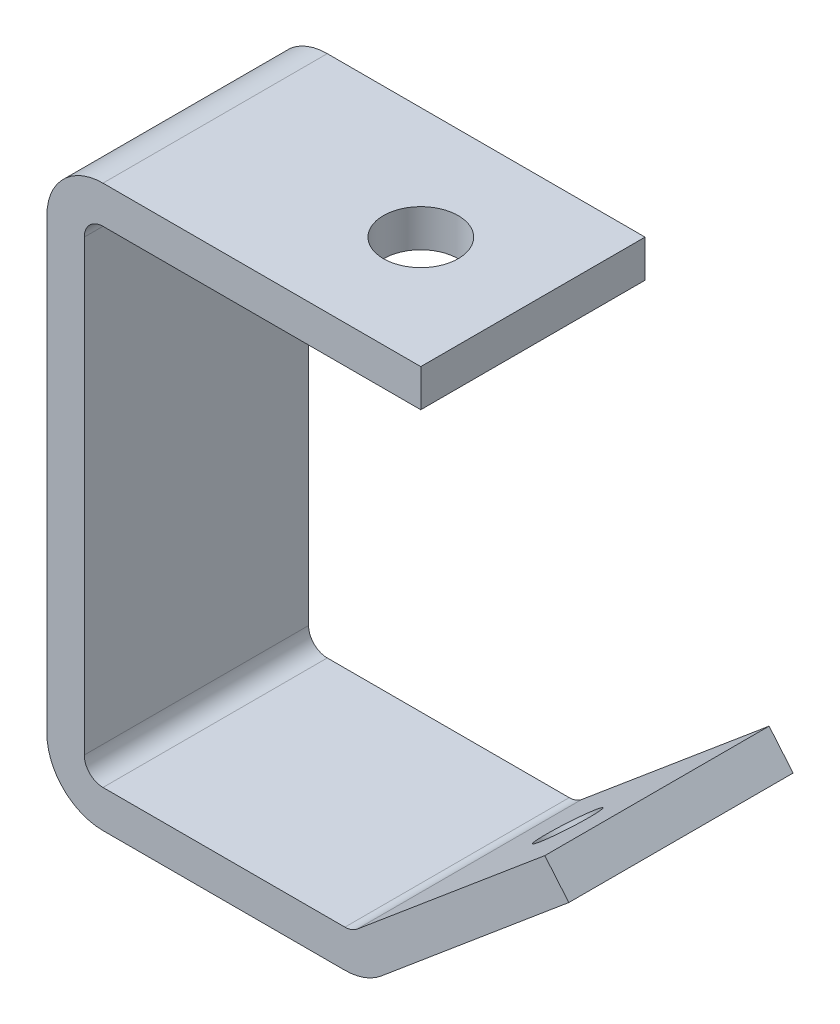
from build123d import *

# Parameters (mm, degrees)
BOSS_EXTRUDE1_DEPTH = 19.05
SKETCH2_R           = 6.35
CUT_EXTRUDE1_DEPTH  = 21.43
SKETCH3_R           = 4.765
CUT_EXTRUDE2_DEPTH  = 46.1


with BuildPart() as part:
    # Sketch1 → Boss-Extrude1 (new, symmetric)
    with BuildSketch(Plane.XY):
        with BuildLine():
            Line((-3.494114249, 0), (-44.59, 0))
            ThreePointArc((-44.59, 0), (-51.328727625, 2.791272375), (-54.12, 9.53))
            Line((-54.12, 9.53), (-54.12, 85.72))
            ThreePointArc((-54.12, 85.72), (-51.328727625, 92.458727625), (-44.59, 95.25))
            Line((-44.59, 95.25), (9.39, 95.25))
            Line((9.39, 95.25), (9.39, 88.9))
            Line((9.39, 88.9), (-44.59, 88.9))
            ThreePointArc((-44.59, 88.9), (-46.838599564, 87.968599564), (-47.77, 85.72))
            Line((-47.77, 85.72), (-47.77, 9.53))
            ThreePointArc((-47.77, 9.53), (-46.838599564, 7.281400436), (-44.59, 6.35))
            Line((-44.59, 6.35), (-3.494114249, 6.35))
            ThreePointArc((-3.494114249, 6.35), (-2.382548783, 6.545998982), (-1.405054517, 7.11035556))
            Line((-1.405054517, 7.11035556), (30.459242619, 33.847675535))
            Line((30.459242619, 33.847675535), (34.54094394, 28.983293321))
            Line((34.54094394, 28.983293321), (2.676646804, 2.245973346))
            ThreePointArc((2.676646804, 2.245973346), (-0.210720873, 0.57895084), (-3.494114249, 0))
        make_face()
    extrude(amount=BOSS_EXTRUDE1_DEPTH, both=True)

    # Sketch2 → Cut-Extrude1 (cut)
    with BuildSketch(Plane(origin=(0, 95.25, 0), x_dir=(1, 0, 0), z_dir=(0, 1, 0))):
        with Locations(Location((-9.65, 0, 0), (0, 0, 270))):
            Circle(SKETCH2_R)
    extrude(amount=-CUT_EXTRUDE1_DEPTH, mode=Mode.SUBTRACT)

    # Sketch3 → Cut-Extrude2 (cut)
    with BuildSketch(Plane(origin=(-4.081701322, 4.864382214, 0), x_dir=(0.7660444431189815, 0.6427876096865353, 0), z_dir=(-0.6427876096865353, 0.7660444431189815, 0))):
        with Locations(Location((25.29, 0, 0), (0, 0, 180))):
            Circle(SKETCH3_R)
    extrude(amount=-CUT_EXTRUDE2_DEPTH, mode=Mode.SUBTRACT)


solid = part.part
